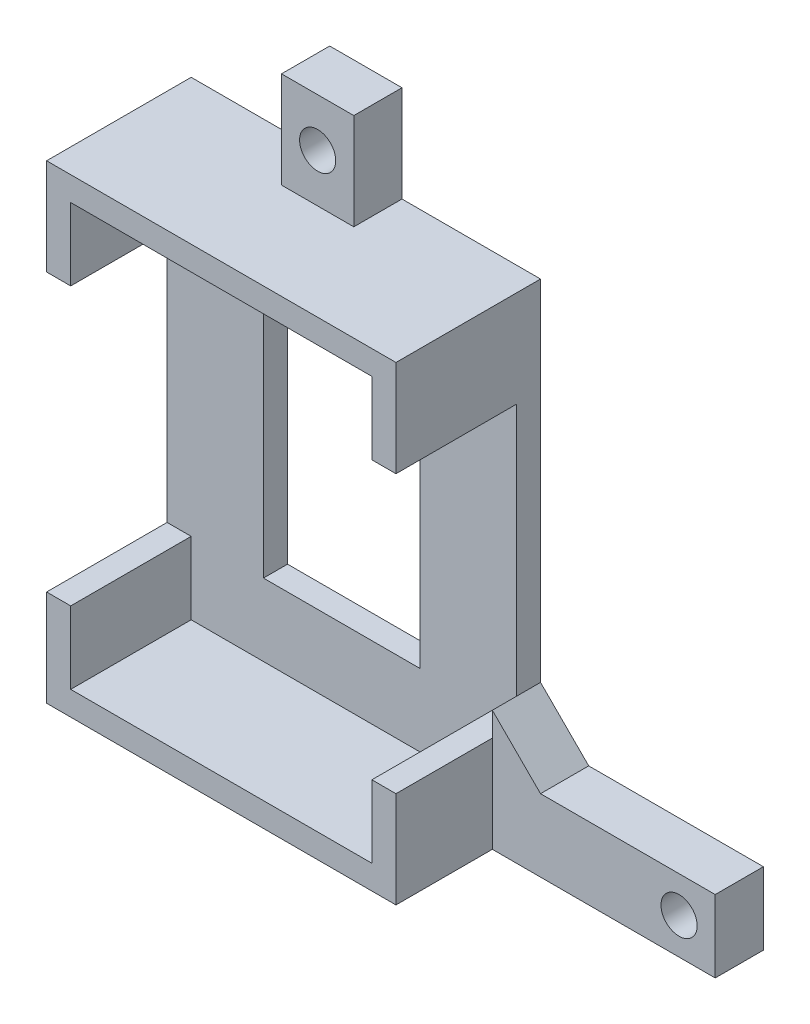
from build123d import *

# Parameters (mm, degrees)
SKETCH_1_W          = 29
SKETCH_1_H          = 39
SKETCH_1_W_2        = 25
SKETCH_1_H_2        = 35
EXTRUDE_1_DEPTH     = 10
SKETCH_4_W          = 2
SKETCH_4_H          = 23
CUT_EXTRUDE_2_DEPTH = 10
SKETCH_5_W          = 29
SKETCH_5_H          = 39
EXTRUDE_1_2_DEPTH   = 2
SKETCH_7_W          = 6
SKETCH_7_H          = 8
SKETCH_7_R          = 1.5
EXTRUDE_2_DEPTH     = 4
SKETCH_9_W          = 13
SKETCH_9_H          = 23
CUT_EXTRUDE_3_DEPTH = 4


with BuildPart() as part:
    # 草图1 → Extrude 1 (new body)
    with BuildSketch(Plane.XY):
        with Locations((-12.5, 17.5)):
            Rectangle(SKETCH_1_W, SKETCH_1_H)
        with Locations((-12.5, 17.5)):
            Rectangle(SKETCH_1_W_2, SKETCH_1_H_2, mode=Mode.SUBTRACT)
    extrude(amount=EXTRUDE_1_DEPTH)

    # 草图4 → 切除-拉伸2 (cut)
    with BuildSketch(Plane.XY.offset(10)):
        with Locations((1, 17.5)):
            Rectangle(SKETCH_4_W, SKETCH_4_H)
        with Locations((-26, 17.5)):
            Rectangle(SKETCH_4_W, SKETCH_4_H)
    extrude(amount=-CUT_EXTRUDE_2_DEPTH, mode=Mode.SUBTRACT)


with BuildPart() as cut_extrude_2_piece_1:
    # of the separate pieces the step leaves, piece 1, a body of its own (cut_extrude_2_pieces)
    add(part.part.solids().sort_by_distance((-27, 37, 0))[0])

    # 草图5 → Extrude 1 2 (add)
    with BuildSketch(Plane(origin=(0, 0, 0), x_dir=(-1, 0, 0), z_dir=(0, 0, -1))):
        with Locations((12.5, 17.5)):
            Rectangle(SKETCH_5_W, SKETCH_5_H)
    extrude(amount=EXTRUDE_1_2_DEPTH)

    # 草图7 → 凸台-拉伸2 (add)
    # profile 1 of 2: a face of its own
    with BuildSketch(Plane(origin=(0, 0, -2), x_dir=(-1, 0, 0), z_dir=(0, 0, -1))):
        with Locations((12.5, 41)):
            Rectangle(SKETCH_7_W, SKETCH_7_H)
        with Locations((12.5, 41)):
            Circle(SKETCH_7_R, mode=Mode.SUBTRACT)
    # profile 2 of 2: a face of its own
    with BuildSketch(Plane(origin=(0, 0, -2), x_dir=(-1, 0, 0), z_dir=(0, 0, -1))):
        Polygon((-2, 4), (-2, 8), (-6, 4), (-20.5, 4), (-20.5, -2), (-2, -2), align=None)
        with Locations((-17.5, 1)):
            Circle(SKETCH_7_R, mode=Mode.SUBTRACT)
    extrude(amount=-EXTRUDE_2_DEPTH)

    # 草图9 → 切除-拉伸3 (cut)
    with BuildSketch(Plane.XY):
        with Locations((-12.5, 17.5)):
            Rectangle(SKETCH_9_W, SKETCH_9_H)
    extrude(amount=-CUT_EXTRUDE_3_DEPTH, mode=Mode.SUBTRACT)


with BuildPart() as cut_extrude_2_piece_2:
    # of the separate pieces the step leaves, piece 2, a body of its own (cut_extrude_2_pieces)
    add(part.part.solids().sort_by_distance((-27, -2, 0))[0])


solid = Compound([cut_extrude_2_piece_1.part, cut_extrude_2_piece_2.part])
